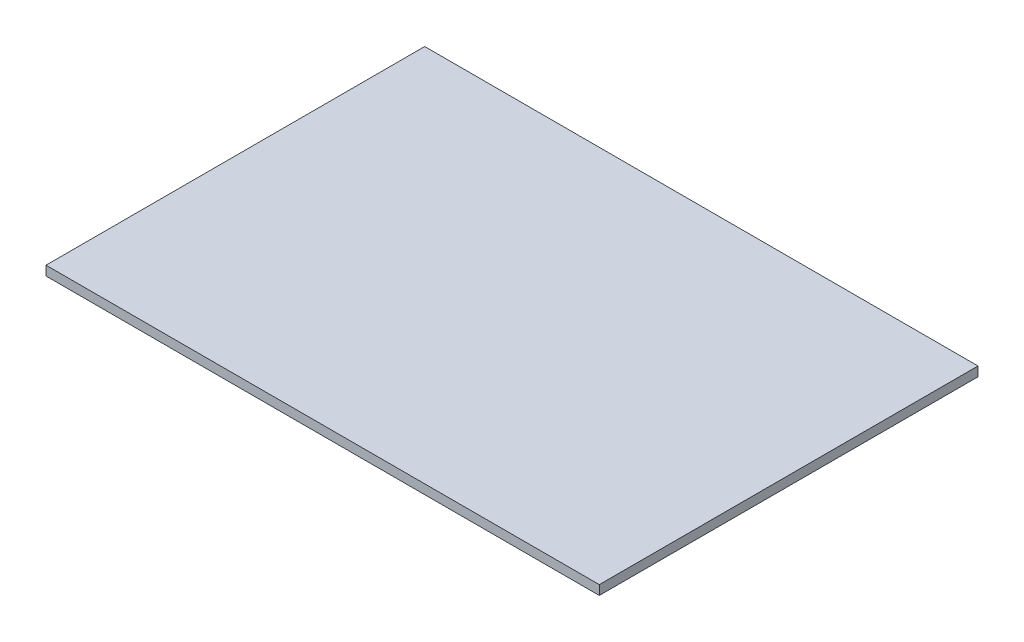
from build123d import *

# Parameters (mm, degrees)
SKETCH1_W           = 206
SKETCH1_H           = 141
BOSS_EXTRUDE1_DEPTH = 3.5
SKETCH1_3_R         = 1.972314148
CUT_EXTRUDE1_DEPTH  = 1.85


with BuildPart() as part:
    # Sketch1 → Boss-Extrude1 (new body)
    with BuildSketch(Plane(origin=(0, 0, 0), x_dir=(1, 0, 0), z_dir=(0, 1, 0))):
        with Locations((103, 70.5)):
            Rectangle(SKETCH1_W, SKETCH1_H)
    extrude(amount=BOSS_EXTRUDE1_DEPTH)

    # Sketch1<3> → Cut-Extrude1 (cut)
    with BuildSketch(Plane(origin=(0, 0, 0), x_dir=(1, 0, 0), z_dir=(0, 1, 0))):
        with Locations((4.5, 4.5)):
            Circle(SKETCH1_3_R)
        with Locations((201.5, 104.5)):
            Circle(SKETCH1_3_R)
        with Locations((201.5, 4.5)):
            Circle(SKETCH1_3_R)
        with Locations((4.5, 136.5)):
            Circle(SKETCH1_3_R)
    extrude(amount=CUT_EXTRUDE1_DEPTH, mode=Mode.SUBTRACT)


solid = part.part
